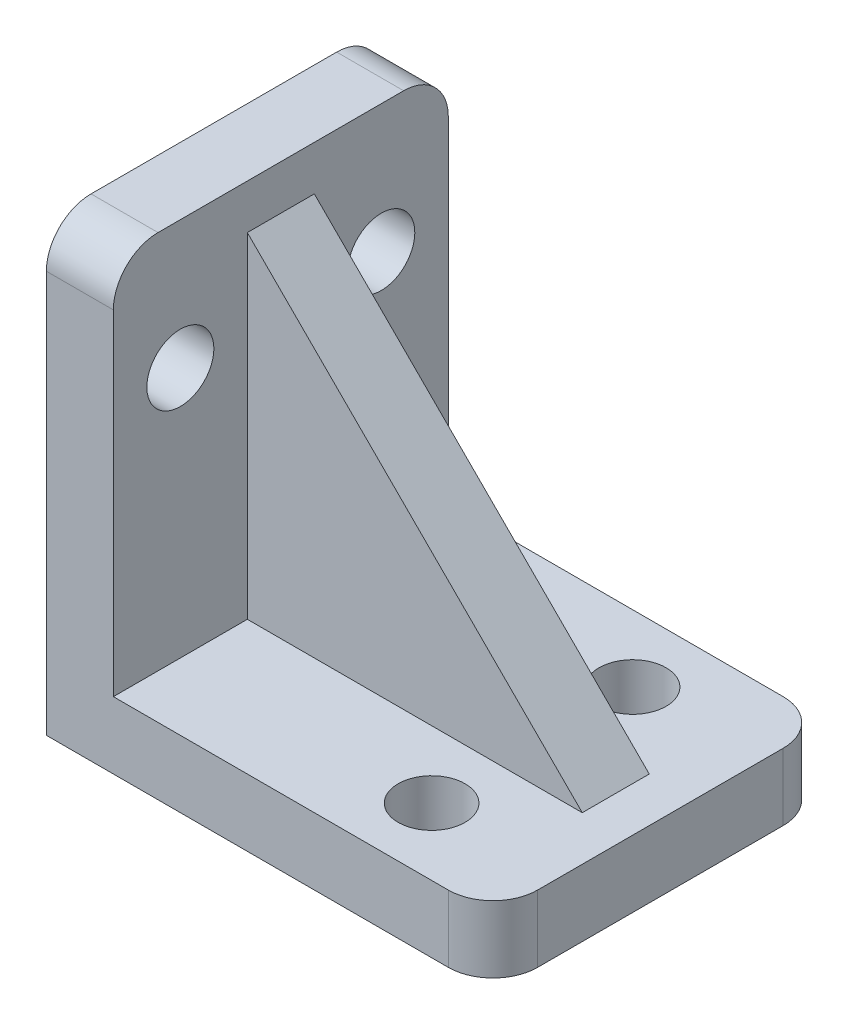
from build123d import *

# Parameters (mm, degrees)
BOSS_EXTRUDE1_DEPTH = 15
GUSSET1_THICKNESS   = 3
SKETCH3_R           = 1.5
CUT_EXTRUDE1_DEPTH  = 15
SKETCH4_R           = 1.5
CUT_EXTRUDE2_DEPTH  = 15
FILLET1_R           = 2


with BuildPart() as part:
    # Sketch1 → Boss-Extrude1 (new body)
    with BuildSketch(Plane.XY):
        Polygon((-7.634854772, 12.323651452), (-7.634854772, -7.676348548), (12.365145228, -7.676348548), (12.365145228, -4.676348548), (-4.634854772, -4.676348548), (-4.634854772, 12.323651452), align=None)
    extrude(amount=BOSS_EXTRUDE1_DEPTH)

    # Sketch3 → Cut-Extrude1 (cut)
    with BuildSketch(Plane(origin=(-4.634854772, 0, 0), x_dir=(0, 0, -1), z_dir=(1, 0, 0))):
        with BuildLine():
            ThreePointArc((-10.5, 6.576602629), (-10.939339828, 7.637262801), (-12, 8.076602629))
            Line((-12, 8.076602629), (-12, 5.076602629))
            ThreePointArc((-12, 5.076602629), (-10.939339828, 5.515942457), (-10.5, 6.576602629))
        make_face()
        with BuildLine():
            Line((-12, 5.076602629), (-12, 8.076602629))
            ThreePointArc((-12, 8.076602629), (-13.5, 6.576602629), (-12, 5.076602629))
        make_face()
        with Locations(Location((-3, 6.576602629, 0), (0, 0, 90))):
            Circle(SKETCH3_R)
    extrude(amount=-CUT_EXTRUDE1_DEPTH, mode=Mode.SUBTRACT)

    # Sketch4 → Cut-Extrude2 (cut)
    with BuildSketch(Plane(origin=(0, -4.676348548, 0), x_dir=(1, 0, 0), z_dir=(0, 1, 0))):
        with BuildLine():
            ThreePointArc((5.118096405, -3), (6.618096405, -4.5), (8.118096405, -3))
            Line((8.118096405, -3), (5.118096405, -3))
        make_face()
        with BuildLine():
            Line((5.118096405, -3), (8.118096405, -3))
            ThreePointArc((8.118096405, -3), (6.618096405, -1.5), (5.118096405, -3))
        make_face()
        with Locations(Location((6.618096405, -12, 0), (0, 0, 180))):
            Circle(SKETCH4_R)
    extrude(amount=-CUT_EXTRUDE2_DEPTH, mode=Mode.SUBTRACT)

    # Fillet1
    fillet1_edges = [part.edges().sort_by_distance(p)[0] for p in [
        (12.365145228, -6.176348548, 15),
        (-6.134854772, 12.323651452, 15),
        (12.365145228, -6.176348548, 0),
        (-6.134854772, 12.323651452, 0),
    ]]
    fillet(fillet1_edges, radius=FILLET1_R)


with BuildPart() as body_2:
    # Gusset1: a gusset: a plate 3.0 thick in the corner of two members, its outline drawn in place
    gusset1_outline = Wire([Line((-4.634854772, -4.676348548, 6), (-4.634854772, 10.323651452, 6)), Line((-4.634854772, 10.323651452, 6), (10.365145228, -4.676348548, 6)), Line((10.365145228, -4.676348548, 6), (-4.634854772, -4.676348548, 6))])
    add(extrude(Face(gusset1_outline), amount=GUSSET1_THICKNESS, dir=(0, 0, 1)))


solid = Compound([part.part, body_2.part])
